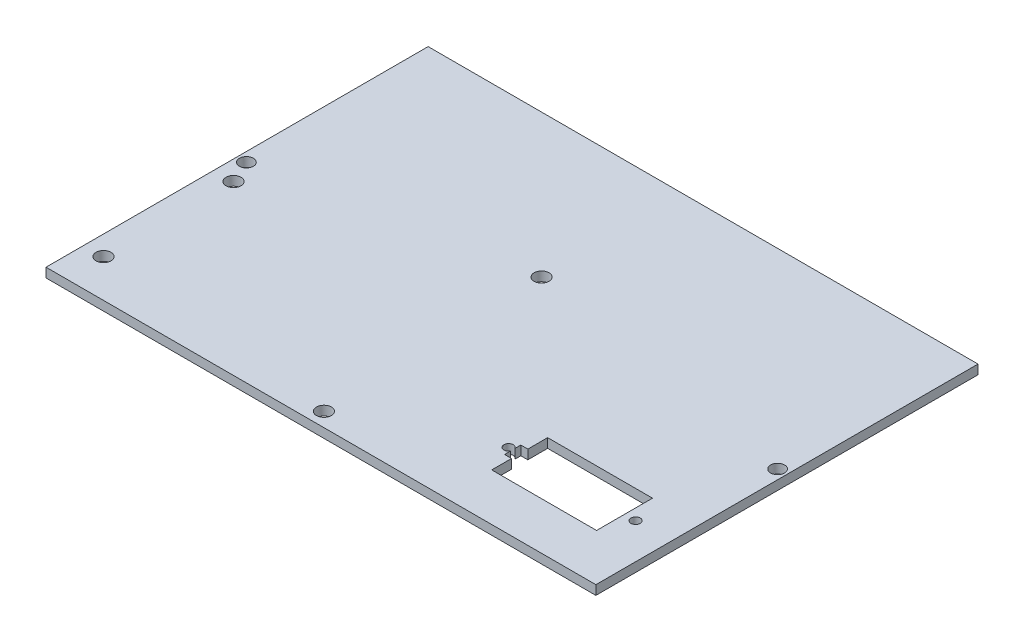
from build123d import *

# Parameters (mm, degrees)
SKETCH1_W           = 118
SKETCH1_H           = 82
BOSS_EXTRUDE1_DEPTH = 2
SKETCH3_R           = 1.5
CUT_EXTRUDE5_DEPTH  = 10
SKETCH4_R           = 1.6
CUT_EXTRUDE6_DEPTH  = 10
SKETCH7_R           = 1
SKETCH7_W           = 1.5
SKETCH7_H           = 3.5
CUT_EXTRUDE7_DEPTH  = 10
SKETCH5_W           = 22.5
SKETCH5_H           = 12
CUT_EXTRUDE8_DEPTH  = 10


with BuildPart() as part:
    # Sketch1 → Boss-Extrude1 (new body)
    with BuildSketch(Plane(origin=(0, 0, 0), x_dir=(1, 0, 0), z_dir=(0, 1, 0))):
        Rectangle(SKETCH1_W, SKETCH1_H)
    extrude(amount=BOSS_EXTRUDE1_DEPTH)

    # Sketch3 → Cut-Extrude5 (cut)
    with BuildSketch(Plane(origin=(0, 2, 0), x_dir=(1, 0, 0), z_dir=(0, 1, 0))):
        with Locations(Location((-57, 0, 0), (0, 0, 270))):
            Circle(SKETCH3_R)
        with Locations(Location((57, 0, 0), (0, 0, 90))):
            Circle(SKETCH3_R)
    extrude(amount=-CUT_EXTRUDE5_DEPTH, mode=Mode.SUBTRACT)

    # Sketch4 → Cut-Extrude6 (cut)
    with BuildSketch(Plane.XZ):
        with Locations(Location((-2.4, 37.960584027, 0), (0, 0, 270))):
            Circle(SKETCH4_R)
        with Locations(Location((-54.8, 32.860584027, 0), (0, 0, 270))):
            Circle(SKETCH4_R)
        with Locations(Location((-4, -10.339415973, 0), (0, 0, 270))):
            Circle(SKETCH4_R)
        with Locations(Location((-54.8, 4.960584027, 0), (0, 0, 270))):
            Circle(SKETCH4_R)
    extrude(amount=-CUT_EXTRUDE6_DEPTH, mode=Mode.SUBTRACT)

    # Sketch7 → Cut-Extrude7 (cut)
    with BuildSketch(Plane(origin=(0, 2, 0), x_dir=(1, 0, 0), z_dir=(0, 1, 0))):
        with Locations((24.125, -24.85)):
            Circle(SKETCH7_R)
        with Locations(Location((51.375, -24.85, 0), (0, 0, 270))):
            Circle(SKETCH7_R)
        with Locations((25.75, -24.85)):
            Rectangle(SKETCH7_W, SKETCH7_H)
    extrude(amount=-CUT_EXTRUDE7_DEPTH, mode=Mode.SUBTRACT)

    # Sketch5 → Cut-Extrude8 (cut)
    with BuildSketch(Plane(origin=(0, 2, 0), x_dir=(1, 0, 0), z_dir=(0, 1, 0))):
        with Locations((37.75, -24.85)):
            Rectangle(SKETCH5_W, SKETCH5_H)
    extrude(amount=-CUT_EXTRUDE8_DEPTH, mode=Mode.SUBTRACT)


solid = part.part
